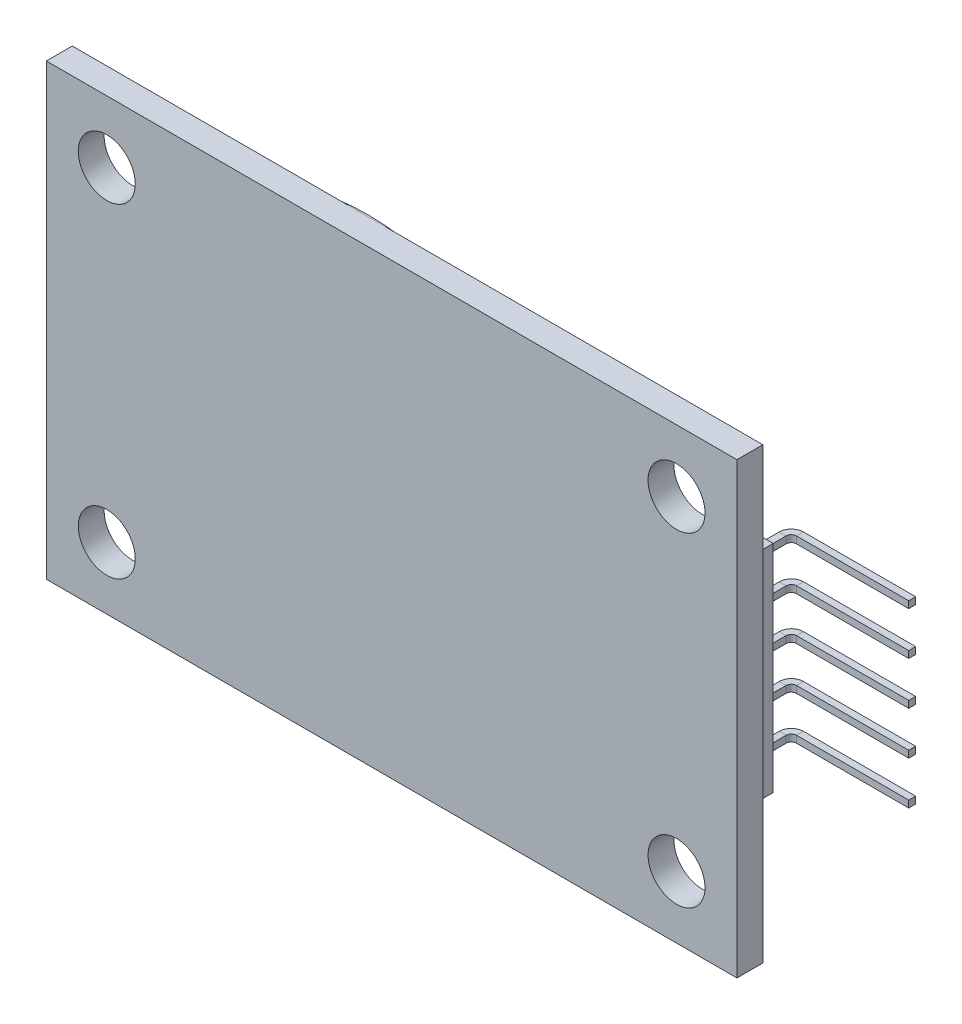
from build123d import *

# Parameters (mm, degrees)
SKETCH_1_W          = 40
SKETCH_1_H          = 26
EXTRUDE_1_DEPTH     = 1.5
SKETCH_2_R          = 1.65
CUT_EXTRUDE_1_DEPTH = 1.5
SKETCH_3_R          = 13
EXTRUDE_2_DEPTH     = 0.1
SKETCH_4_W          = 2.5
SKETCH_4_H          = 12.5
EXTRUDE_3_DEPTH     = 2.1
SKETCH_5_W          = 0.4
SKETCH_5_H          = 0.4


with BuildPart() as part:
    # 草图1 → 凸台-拉伸1 (new body)
    with BuildSketch(Plane.XY):
        Rectangle(SKETCH_1_W, SKETCH_1_H)
    extrude(amount=EXTRUDE_1_DEPTH)

    # 草图2 → 切除-拉伸1 (cut)
    with BuildSketch(Plane.XY.offset(1.5)):
        with Locations((-16.5, 9.4)):
            Circle(SKETCH_2_R)
        with Locations((16.5, 9.4)):
            Circle(SKETCH_2_R)
        with Locations((16.5, -9.4)):
            Circle(SKETCH_2_R)
        with Locations((-16.5, -9.4)):
            Circle(SKETCH_2_R)
    extrude(amount=-CUT_EXTRUDE_1_DEPTH, mode=Mode.SUBTRACT)

    # 草图3 → 凸台-拉伸2 (add)
    with BuildSketch(Plane(origin=(0, 0, 0), x_dir=(-1, 0, 0), z_dir=(0, 0, -1))):
        with Locations(Location((3, 0, 0), (0, 0, 270))):
            Circle(SKETCH_3_R)
    extrude(amount=EXTRUDE_2_DEPTH)

    # 草图4 → 凸台-拉伸3 (add)
    with BuildSketch(Plane(origin=(0, 0, 0), x_dir=(-1, 0, 0), z_dir=(0, 0, -1))):
        with Locations((-17.25, 0)):
            Rectangle(SKETCH_4_W, SKETCH_4_H)
    extrude(amount=EXTRUDE_3_DEPTH)

    # 扫描1: sweep along a path in 草图6
    with BuildLine(Plane(origin=(0, 5.2, 0), x_dir=(-1, 0, 0), z_dir=(0, -1, 0))) as sweep_1_path:
        Line((-17.25, 2.1), (-17.25, 3.9))
        ThreePointArc((-17.25, 3.9), (-17.396446609, 4.253553391), (-17.75, 4.4))
        Line((-17.75, 4.4), (-24.25, 4.4))
    # 草图5 → 扫描1 (sweep)
    with BuildSketch(Plane(origin=(0, 0, -2.1), x_dir=(-1, 0, 0), z_dir=(0, 0, -1))):
        with Locations((-17.25, 2.5)):
            Rectangle(SKETCH_5_W, SKETCH_5_H)
        with Locations((-17.25, 5)):
            Rectangle(SKETCH_5_W, SKETCH_5_H)
        with Locations((-17.25, 0)):
            Rectangle(SKETCH_5_W, SKETCH_5_H)
        with Locations((-17.25, -2.5)):
            Rectangle(SKETCH_5_W, SKETCH_5_H)
        with Locations((-17.25, -5)):
            Rectangle(SKETCH_5_W, SKETCH_5_H)
    sweep(path=sweep_1_path.line)


solid = part.part
